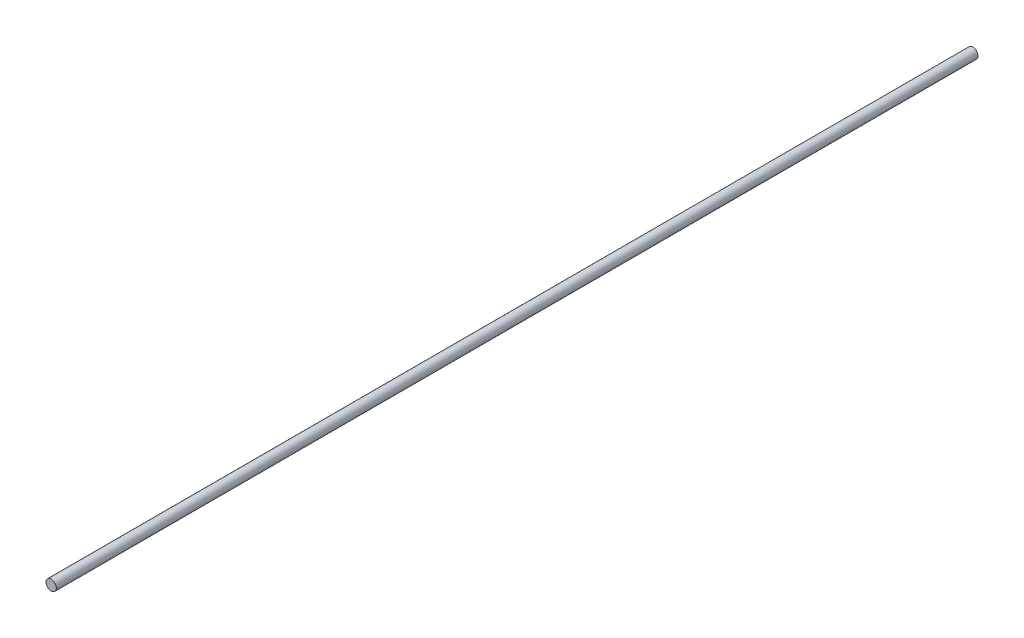
from build123d import *

# Parameters (mm, degrees)
ESBO_O1_R                = 3.815
RESSALTO_EXTRUS_O1_DEPTH = 681


with BuildPart() as part:
    # Esboço1 → Ressalto-extrusão1 (new body)
    with BuildSketch(Plane.XY):
        Circle(ESBO_O1_R)
    extrude(amount=RESSALTO_EXTRUS_O1_DEPTH)


solid = part.part
